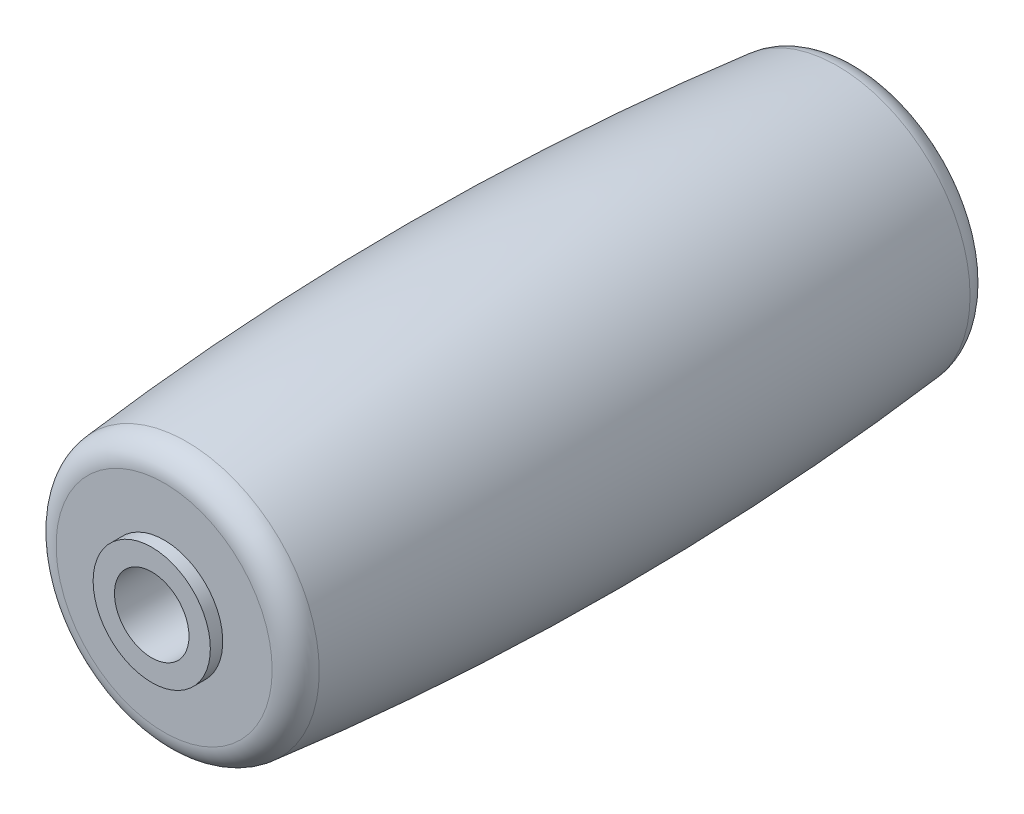
from build123d import *

# Parameters (mm, degrees)
SKETCH_2_R          = 1.5
CUT_EXTRUDE_1_DEPTH = 28
SKETCH_2_4_R        = 3.75
SKETCH_2_4_R_2      = 1.5
CUT_EXTRUDE_2_DEPTH = 1.5
EXTRUDE_START       = 1.5
SKETCH_4_R          = 3.75
SKETCH_4_R_2        = 1.5
EXTRUDE_2_DEPTH     = 1.5
EXTRUDE_START_2     = 0.5
SKETCH_5_R          = 2.359540806
SKETCH_5_R_2        = 1.5
EXTRUDE_3_DEPTH     = 0.5


with BuildPart() as part:
    # 草图1 → 旋转1 (revolve)
    with BuildSketch(Plane(origin=(0, 0, 0), x_dir=(0, 0, -1), z_dir=(1, 0, 0)), mode=Mode.PRIVATE) as revolve_1_sk:
        with BuildLine():
            Line((-14, 4.348576665), (-14, 0))
            Line((-14, 0), (14, 0))
            Line((14, 0), (14, 4.348576665))
            ThreePointArc((14, 4.348576665), (13.741609048, 5.019408999), (13.099967959, 5.343567322))
            ThreePointArc((13.099967959, 5.343567322), (0, 6), (-13.099967959, 5.343567322))
            ThreePointArc((-13.099967959, 5.343567322), (-13.741609048, 5.019408999), (-14, 4.348576665))
        make_face()
    revolve(revolve_1_sk.sketch.rotate(Axis((0, 0, 14), (0, 0, -1)), 90), axis=Axis((0, 0, 14), (0, 0, -1)))

    # 草图2 → 切除-拉伸1 (cut)
    with BuildSketch(Plane.XY.offset(14)):
        Circle(SKETCH_2_R)
    extrude(amount=-CUT_EXTRUDE_1_DEPTH, mode=Mode.SUBTRACT)

    # 草图2<4> → 切除-拉伸2 (cut)
    with BuildSketch(Plane.XY.offset(14)):
        Circle(SKETCH_2_4_R)
        Circle(SKETCH_2_4_R_2, mode=Mode.SUBTRACT)
    cut_extrude_2 = extrude(amount=-CUT_EXTRUDE_2_DEPTH, mode=Mode.SUBTRACT)

    # 镜向1: 切除-拉伸2 across plane
    add(cut_extrude_2.mirror(Plane.XY), mode=Mode.SUBTRACT)

    # 草图4 → 凸台-拉伸2 (add)
    with BuildSketch(Plane.XY.offset(12.5).offset(EXTRUDE_START)):
        Circle(SKETCH_4_R)
        Circle(SKETCH_4_R_2, mode=Mode.SUBTRACT)
    extrude_2 = extrude(amount=-EXTRUDE_2_DEPTH)

    # 草图5 → 凸台-拉伸3 (add)
    with BuildSketch(Plane.XY.offset(14).offset(EXTRUDE_START_2)):
        with Locations(Location((0, 0, 0), (0, 0, 180))):
            Circle(SKETCH_5_R)
        Circle(SKETCH_5_R_2, mode=Mode.SUBTRACT)
    extrude_3 = extrude(amount=-EXTRUDE_3_DEPTH)

    # 镜向4: 凸台-拉伸2, 凸台-拉伸3 across plane
    add(extrude_2.mirror(Plane.XY))
    add(extrude_3.mirror(Plane.XY))


solid = part.part
